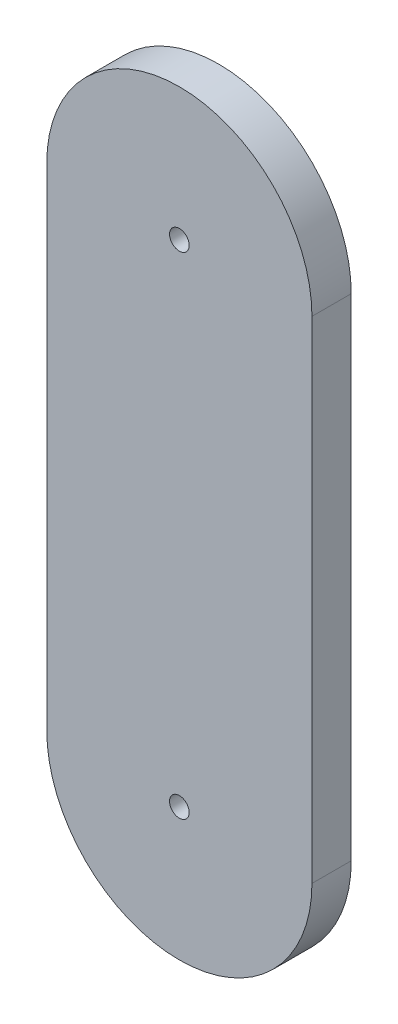
from build123d import *

# Parameters (mm, degrees)
SKETCH1_R           = 5
BOSS_EXTRUDE1_DEPTH = 20


with BuildPart() as part:
    # Sketch1 → Boss-Extrude1 (new body)
    with BuildSketch(Plane.XY):
        with BuildLine():
            Line((-67.5, 0), (-67.5, 250))
            ThreePointArc((-67.5, 250), (0, 317.5), (67.5, 250))
            Line((67.5, 250), (67.5, 0))
            ThreePointArc((67.5, 0), (0, -67.5), (-67.5, 0))
        make_face()
        with Locations((0, 250)):
            Circle(SKETCH1_R, mode=Mode.SUBTRACT)
        Circle(SKETCH1_R, mode=Mode.SUBTRACT)
    extrude(amount=BOSS_EXTRUDE1_DEPTH)


solid = part.part
